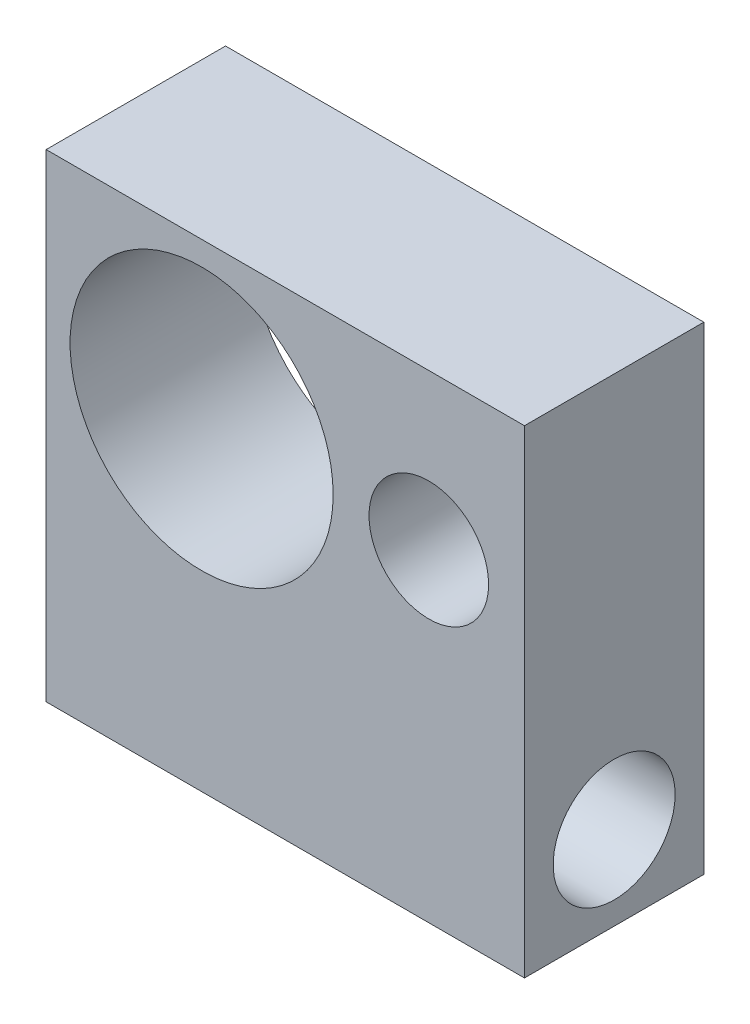
from build123d import *

# Parameters (mm, degrees)
SKETCH2_W           = 40
SKETCH2_H           = 40
SKETCH2_R           = 5
SKETCH2_R_2         = 11
BOSS_EXTRUDE1_DEPTH = 15
SKETCH3_R           = 5.1
CUT_EXTRUDE1_DEPTH  = 48.16990566


with BuildPart() as part:
    # Sketch2 → Boss-Extrude1 (new body)
    with BuildSketch(Plane.XY):
        Rectangle(SKETCH2_W, SKETCH2_H)
        with Locations((12, 7)):
            Circle(SKETCH2_R, mode=Mode.SUBTRACT)
        with Locations((-7, 7)):
            Circle(SKETCH2_R_2, mode=Mode.SUBTRACT)
    extrude(amount=BOSS_EXTRUDE1_DEPTH)

    # Sketch3 → Cut-Extrude1 (cut, through all)
    with BuildSketch(Plane(origin=(20, 0, 0), x_dir=(0, 0, -1), z_dir=(1, 0, 0))):
        with Locations((-7.5, -13)):
            Circle(SKETCH3_R)
    extrude(amount=-CUT_EXTRUDE1_DEPTH, mode=Mode.SUBTRACT)


solid = part.part
